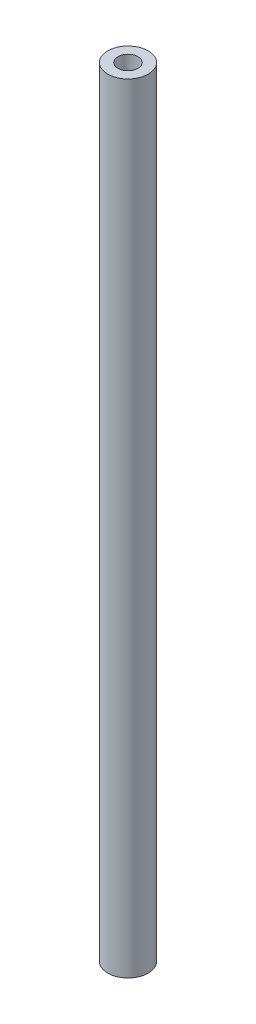
from build123d import *

# Parameters (mm, degrees)
SKETCH1_R           = 9.525
SKETCH1_R_2         = 4.7625
BOSS_EXTRUDE1_DEPTH = 367.03


with BuildPart() as part:
    # Sketch1 → Boss-Extrude1 (new body)
    with BuildSketch(Plane(origin=(0, 0, 0), x_dir=(1, 0, 0), z_dir=(0, 1, 0))):
        with Locations(Location((0, 0, 0), (0, 0, 270))):
            Circle(SKETCH1_R)
        with Locations(Location((0, 0, 0), (0, 0, 270))):
            Circle(SKETCH1_R_2, mode=Mode.SUBTRACT)
    extrude(amount=BOSS_EXTRUDE1_DEPTH)


solid = part.part
